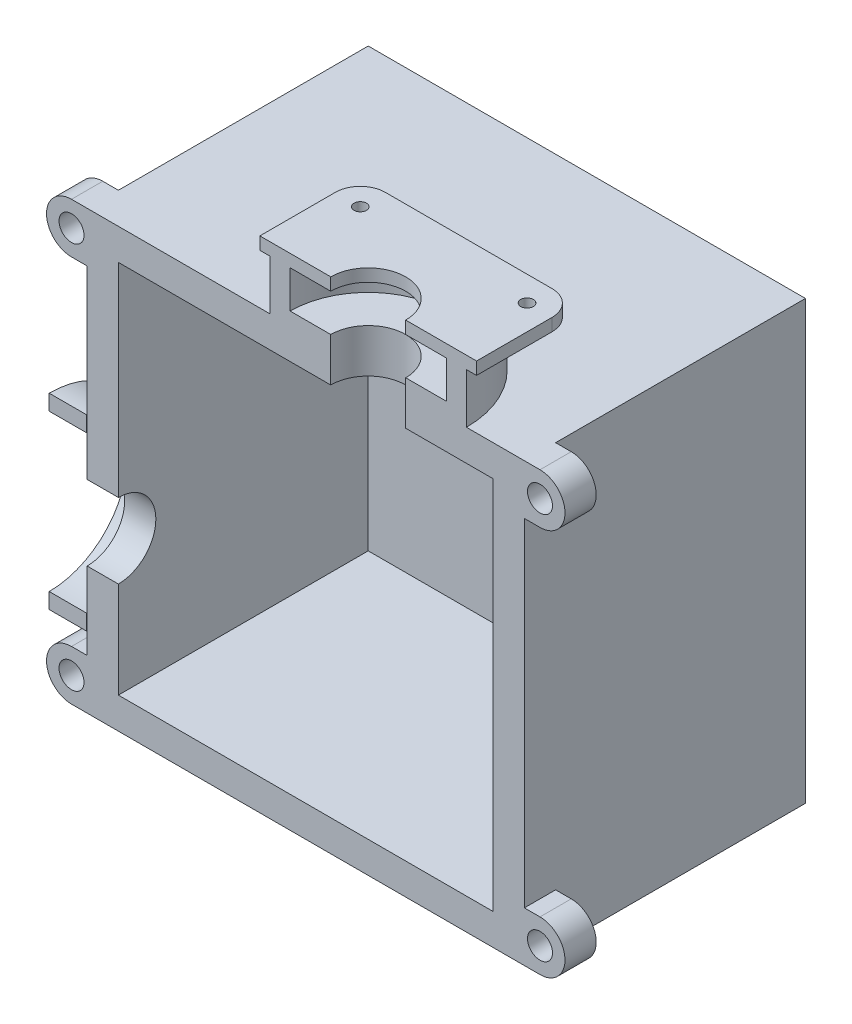
from build123d import *

# Parameters (mm, degrees)
SKETCH_1_W               = 90
SKETCH_1_H               = 90
EXTRUDE_2_DEPTH          = 45
SKETCH_2_W               = 80
SKETCH_2_H               = 80
CUT_EXTRUDE_1_DEPTH      = 40
EXTRUDE_3_DEPTH          = 10
SKETCH_4_R               = 1
EXTRUDE_4_DEPTH          = 2
SKETCH_5_R               = 6
CUT_EXTRUDE_2_DEPTH      = 30
EXTRUDE_5_DEPTH          = 6
CUT_EXTRUDE_START        = -2
CUT_EXTRUDE_3_DEPTH      = 6
SKETCH_8_R               = 12.5
CUT_EXTRUDE_4_DEPTH      = 6
SKETCH_9_R               = 6
CUT_EXTRUDE_5_DEPTH      = 6
SKETCH_10_R              = 2
EXTRUDE_6_DEPTH          = 5
CUT_EXTRUDE_6_DEPTH      = 86.341501801
CUT_EXTRUDE_6_DEPTH_BACK = 86.341501801
EXTRUDE_8_DEPTH          = 5
EXTRUDE_9_REACH          = 89.762
SKETCH_13_W              = 70
SKETCH_13_H              = 5
SKETCH_14_R              = 2
SKETCH_14_W              = 3.535716984
SKETCH_14_H              = 8
EXTRUDE_10_DEPTH         = 5


with BuildPart() as part:
    # 草图1 → 凸台-拉伸2 (new body)
    with BuildSketch(Plane.XY):
        Rectangle(SKETCH_1_W, SKETCH_1_H)
    extrude(amount=EXTRUDE_2_DEPTH)

    # 草图2 → 切除-拉伸1 (cut)
    with BuildSketch(Plane.XY.offset(45)):
        Rectangle(SKETCH_2_W, SKETCH_2_H)
    extrude(amount=-CUT_EXTRUDE_1_DEPTH, mode=Mode.SUBTRACT)

    # 草图3 → 凸台-拉伸3 (add)
    with BuildSketch(Plane(origin=(0, 45, 0), x_dir=(1, 0, 0), z_dir=(0, 1, 0))):
        with BuildLine():
            Line((-15.725, -45), (15.725, -45))
            ThreePointArc((15.725, -45), (0, -29.275), (-15.725, -45))
        make_face()
    extrude(amount=EXTRUDE_3_DEPTH)

    # 草图4 → 凸台-拉伸4 (add)
    with BuildSketch(Plane(origin=(0, 55, 0), x_dir=(1, 0, 0), z_dir=(0, 1, 0))):
        with BuildLine():
            Line((-13.344644505, -28.920245738), (13.344644505, -28.920245738))
            ThreePointArc((13.344644505, -28.920245738), (16.17307163, -30.091818614), (17.344644505, -32.920245738))
            Line((17.344644505, -32.920245738), (17.344644505, -45))
            Line((17.344644505, -45), (-17.344644505, -45))
            Line((-17.344644505, -45), (-17.344644505, -32.920245738))
            ThreePointArc((-17.344644505, -32.920245738), (-16.17307163, -30.091818614), (-13.344644505, -28.920245738))
        make_face()
        with Locations(Location((13.344644505, -32.920245738, 0), (0, 0, 270))):
            Circle(SKETCH_4_R, mode=Mode.SUBTRACT)
        with Locations(Location((-13.344644505, -32.920245738, 0), (0, 0, 270))):
            Circle(SKETCH_4_R, mode=Mode.SUBTRACT)
    extrude(amount=-EXTRUDE_4_DEPTH)

    # 草图5 → 切除-拉伸2 (cut)
    with BuildSketch(Plane(origin=(0, 55, 0), x_dir=(1, 0, 0), z_dir=(0, 1, 0))):
        with Locations((0, -45)):
            Circle(SKETCH_5_R)
    extrude(amount=-CUT_EXTRUDE_2_DEPTH, mode=Mode.SUBTRACT)

    # 草图6 → 凸台-拉伸5 (add)
    with BuildSketch(Plane.ZY.offset(45)):
        with BuildLine():
            Line((45.073955752, 16.4), (45.073955752, -13.6))
            ThreePointArc((45.073955752, -13.6), (30.073955752, 1.4), (45.073955752, 16.4))
        make_face()
    extrude(amount=EXTRUDE_5_DEPTH)

    # 草图7 → 切除-拉伸3 (cut)
    with BuildSketch(Plane(origin=(0, 55, 0), x_dir=(1, 0, 0), z_dir=(0, 1, 0)).offset(CUT_EXTRUDE_START)):
        with BuildLine():
            Line((-12.5, -45), (12.5, -45))
            ThreePointArc((12.5, -45), (0, -32.5), (-12.5, -45))
        make_face()
    extrude(amount=-CUT_EXTRUDE_3_DEPTH, mode=Mode.SUBTRACT)

    # 草图8 → 切除-拉伸4 (cut)
    with BuildSketch(Plane.ZY.offset(51)):
        with Locations((45.073955752, 1.4)):
            Circle(SKETCH_8_R)
    extrude(amount=-CUT_EXTRUDE_4_DEPTH, mode=Mode.SUBTRACT)

    # 草图9 → 切除-拉伸5 (cut)
    with BuildSketch(Plane.ZY.offset(45)):
        with Locations((45, 1.4)):
            Circle(SKETCH_9_R)
    extrude(amount=-CUT_EXTRUDE_5_DEPTH, mode=Mode.SUBTRACT)

    # 草图10 → 凸台-拉伸6 (add)
    # profile 1 of 4: a face of its own
    with BuildSketch(Plane.XY.offset(45)):
        with BuildLine():
            Line((-47.5, 45), (-42.902808048, 45))
            Line((-42.902808048, 45), (-42.902808048, 37))
            Line((-42.902808048, 37), (-47.5, 37))
            ThreePointArc((-47.5, 37), (-51.5, 41), (-47.5, 45))
        make_face()
        with Locations((-47.5, 41)):
            Circle(SKETCH_10_R, mode=Mode.SUBTRACT)
    # profile 2 of 4: a face of its own
    with BuildSketch(Plane.XY.offset(45)):
        with BuildLine():
            Line((-47.5, -45), (-42.902808048, -45))
            Line((-42.902808048, -45), (-42.902808048, -37))
            Line((-42.902808048, -37), (-47.5, -37))
            ThreePointArc((-47.5, -37), (-51.5, -41), (-47.5, -45))
        make_face()
        with Locations((-47.5, -41)):
            Circle(SKETCH_10_R, mode=Mode.SUBTRACT)
    # profile 3 of 4: a face of its own
    with BuildSketch(Plane.XY.offset(45)):
        with BuildLine():
            Line((42.460881889, 45), (42.460881889, 37))
            Line((42.460881889, 37), (47.5, 37))
            ThreePointArc((47.5, 37), (51.5, 41), (47.5, 45))
            Line((47.5, 45), (42.460881889, 45))
        make_face()
        with Locations((47.5, 41)):
            Circle(SKETCH_10_R, mode=Mode.SUBTRACT)
    # profile 4 of 4: a face of its own
    with BuildSketch(Plane.XY.offset(45)):
        with BuildLine():
            Line((41.065096799, -37), (41.065096799, -45))
            Line((41.065096799, -45), (47.5, -45))
            ThreePointArc((47.5, -45), (51.5, -41), (47.5, -37))
            Line((47.5, -37), (41.065096799, -37))
        make_face()
        with Locations((47.5, -41)):
            Circle(SKETCH_10_R, mode=Mode.SUBTRACT)
    extrude(amount=-EXTRUDE_6_DEPTH)

    # 草图11 → 切除-拉伸6 (cut, two sides: drawn at the far end of the back side and taken through both)
    with BuildSketch(Plane.XY.offset(5).offset(-CUT_EXTRUDE_6_DEPTH_BACK)):
        Polygon((25, 25), (25, 60.762211799), (85.89289348, 60.762211799), (85.89289348, -73.939659246), (-86.710921037, -73.939659246), (-86.710921037, -25), (-25, -25), (25, -25), align=None)
    extrude(amount=CUT_EXTRUDE_6_DEPTH + CUT_EXTRUDE_6_DEPTH_BACK, mode=Mode.SUBTRACT)

    # 草图12 → 凸台-拉伸8 (add)
    with BuildSketch(Plane(origin=(25, 0, 0), x_dir=(0, 0, -1), z_dir=(1, 0, 0))):
        Polygon((-45, 40), (-45, -25), (-5, -25), (0, -25), (0, 45), (-45, 45), align=None)
    extrude(amount=-EXTRUDE_8_DEPTH)

    # 草图13 → 凸台-拉伸9 (add, up to next)
    with BuildSketch(Plane.XY.offset(45), mode=Mode.PRIVATE) as extrude_9_sk1:
        with Locations((-10, -22.5)):
            Rectangle(SKETCH_13_W, SKETCH_13_H)
    extrude_9_tool1 = extrude(extrude_9_sk1.sketch, amount=-EXTRUDE_9_REACH, mode=Mode.PRIVATE) - part.part
    add(extrude_9_tool1.solids().sort_by_distance((-10, -22.5, 45))[0])

    # 草图14 → 凸台-拉伸10 (add)
    # profile 1 of 5: a face of its own
    with BuildSketch(Plane.XY.offset(45)):
        with BuildLine():
            Line((27.5, 45), (25, 45))
            Line((25, 45), (25, 37))
            Line((25, 37), (27.5, 37))
            ThreePointArc((27.5, 37), (31.5, 41), (27.5, 45))
        make_face()
        with Locations((27.5, 41)):
            Circle(SKETCH_14_R, mode=Mode.SUBTRACT)
    # profile 2 of 5: a face of its own
    with BuildSketch(Plane.XY.offset(45)):
        with Locations((-43.232141508, -21)):
            Rectangle(SKETCH_14_W, SKETCH_14_H)
    # profile 3 of 5: a face of its own
    with BuildSketch(Plane.XY.offset(45)):
        with Locations((23.232141508, -21)):
            Rectangle(SKETCH_14_W, SKETCH_14_H)
    # profile 4 of 5: a face of its own
    with BuildSketch(Plane.XY.offset(45)):
        with BuildLine():
            Line((27.5, -17), (25, -17))
            Line((25, -17), (25, -25))
            Line((25, -25), (27.5, -25))
            ThreePointArc((27.5, -25), (31.5, -21), (27.5, -17))
        make_face()
        with Locations((27.5, -21)):
            Circle(SKETCH_14_R, mode=Mode.SUBTRACT)
    # profile 5 of 5: a face of its own
    with BuildSketch(Plane.XY.offset(45)):
        with BuildLine():
            Line((-47.5, -25), (-45, -25))
            Line((-45, -25), (-45, -17))
            Line((-45, -17), (-47.5, -17))
            ThreePointArc((-47.5, -17), (-51.5, -21), (-47.5, -25))
        make_face()
        with Locations((-47.5, -21)):
            Circle(SKETCH_14_R, mode=Mode.SUBTRACT)
    extrude(amount=-EXTRUDE_10_DEPTH)


solid = part.part
